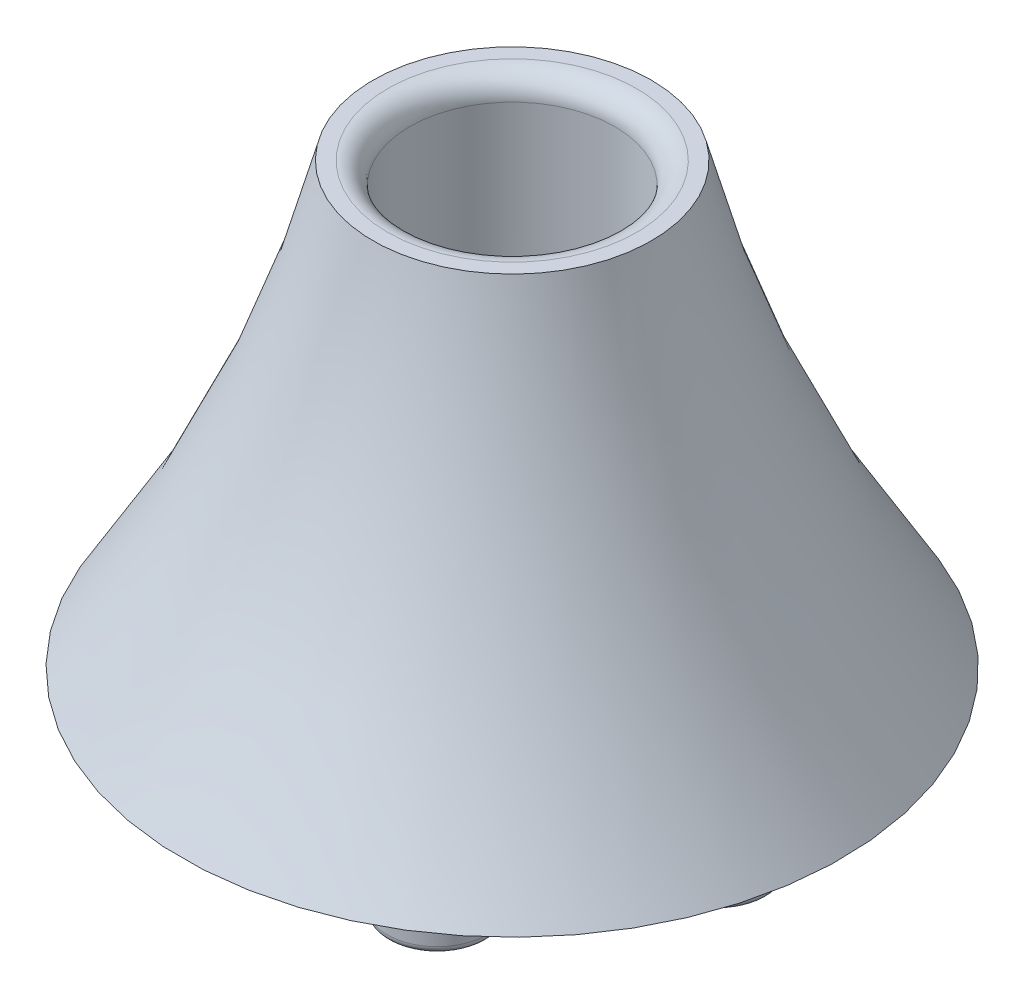
from build123d import *

# Parameters (mm, degrees)
SKETCH3_R           = 3.4
BOSS_EXTRUDE1_DEPTH = 5
FILLET1_R           = 1.5
FILLET2_R           = 1.5
FILLET3_R           = 0.5


with BuildPart() as part:
    # Sketch2 → Revolve1 (revolve)
    with BuildSketch(Plane(origin=(0, 0, 0), x_dir=(0, 0, -1), z_dir=(1, 0, 0)), mode=Mode.PRIVATE) as revolve1_sk:
        with BuildLine():
            Line((-7.772106951, 0), (-7, 0))
            Line((-7, 0), (-7, 30))
            Line((-7, 30), (-9.5, 30))
            ThreePointArc((-9.5, 30), (-14.683716109, 14.429610314), (-22.5, 0))
            Line((-22.5, 0), (-7.772106951, 0))
        make_face()
    revolve(revolve1_sk.sketch.rotate(Axis((0, 0, 0), (0, 1, 0)), 180), axis=Axis((0, 0, 0), (0, 1, 0)))

    # Sketch3 → Boss-Extrude1 (add)
    with BuildSketch(Plane(origin=(0, 0, 0), x_dir=(-1, 0, 0), z_dir=(0, -1, 0))):
        with Locations(Location((-14, 0, 0), (0, 0, 90))):
            Circle(SKETCH3_R)
        with Locations(Location((-7, 12.124355653, 0), (0, 0, 90))):
            Circle(SKETCH3_R)
        with Locations(Location((7, 12.124355653, 0), (0, 0, 90))):
            Circle(SKETCH3_R)
        with Locations(Location((14, 0, 0), (0, 0, 90))):
            Circle(SKETCH3_R)
        with Locations(Location((7, -12.124355653, 0), (0, 0, 90))):
            Circle(SKETCH3_R)
        with Locations(Location((-7, -12.124355653, 0), (0, 0, 90))):
            Circle(SKETCH3_R)
    extrude(amount=BOSS_EXTRUDE1_DEPTH)

    # Fillet1
    fillet1_edges = [part.edges().sort_by_distance(p)[0] for p in [
        (0, 30, 7),
    ]]
    fillet(fillet1_edges, radius=FILLET1_R)

    # Fillet2
    fillet2_edges = [part.edges().sort_by_distance(p)[0] for p in [
        (0, 0, 7),
    ]]
    fillet(fillet2_edges, radius=FILLET2_R)

    # Fillet3
    fillet3_edges = [part.edges().sort_by_distance(p)[0] for p in [
        (14, -5, 3.4),
        (7, -5, 15.524355653),
        (-7, -5, 15.524355653),
        (-14, -5, 3.4),
        (-7, -5, -8.724355653),
        (7, -5, -8.724355653),
    ]]
    fillet(fillet3_edges, radius=FILLET3_R)


solid = part.part
